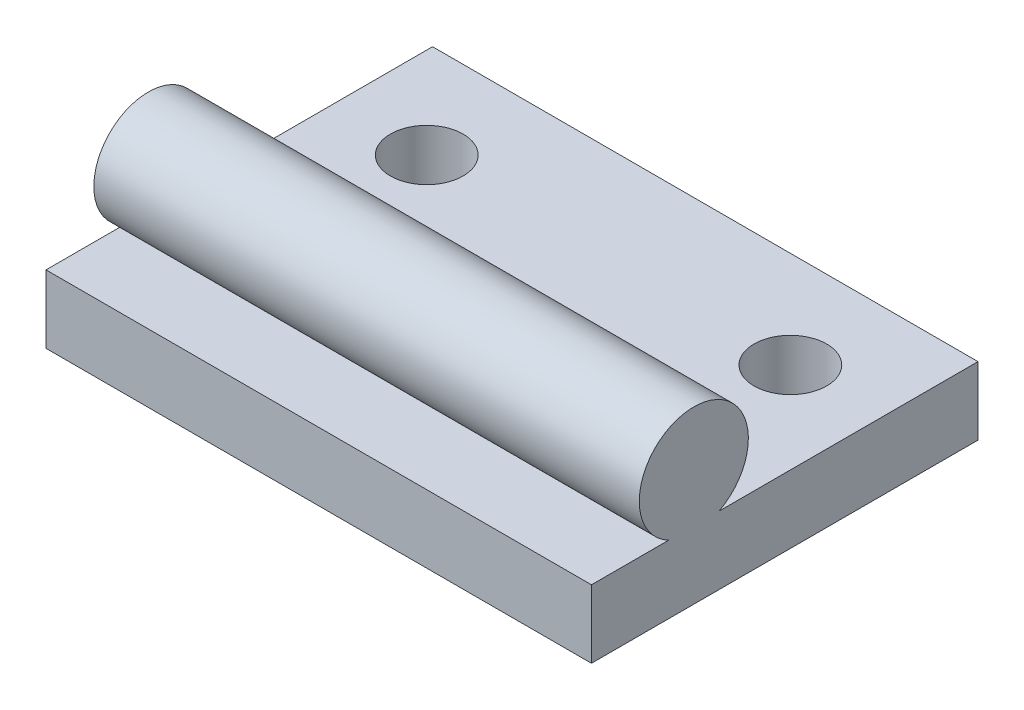
from build123d import *

# Parameters (mm, degrees)
SKETCH1_W           = 38.1
SKETCH1_H           = 12.7
BOSS_EXTRUDE1_DEPTH = 4.7498
SKETCH2_R           = 2.54
CUT_EXTRUDE1_DEPTH  = 4.7498
SKETCH4_W           = 38.1
SKETCH4_H           = 4.749919389
BOSS_EXTRUDE2_DEPTH = 14.3002
SKETCH5_R           = 3.81
BOSS_EXTRUDE3_DEPTH = 38.1


with BuildPart() as part:
    # Sketch1 → Boss-Extrude1 (new body)
    with BuildSketch(Plane(origin=(0, 0, 0), x_dir=(1, 0, 0), z_dir=(0, 1, 0))):
        with Locations((19.05, 6.35)):
            Rectangle(SKETCH1_W, SKETCH1_H)
    extrude(amount=BOSS_EXTRUDE1_DEPTH)

    # Sketch2 → Cut-Extrude1 (cut)
    with BuildSketch(Plane(origin=(0, 4.7498, 0), x_dir=(1, 0, 0), z_dir=(0, 1, 0))):
        with Locations(Location((6.35, 5.9436, 0), (0, 0, 270))):
            Circle(SKETCH2_R)
        with Locations(Location((31.75, 5.9436, 0), (0, 0, 270))):
            Circle(SKETCH2_R)
    extrude(amount=-CUT_EXTRUDE1_DEPTH, mode=Mode.SUBTRACT)

    # Sketch4 → Boss-Extrude2 (add)
    with BuildSketch(Plane.XY):
        with Locations((19.05, 2.374840306)):
            Rectangle(SKETCH4_W, SKETCH4_H)
    extrude(amount=BOSS_EXTRUDE2_DEPTH)

    # Sketch5 → Boss-Extrude3 (add)
    with BuildSketch(Plane.ZY):
        with Locations((7.1501, 8.127910458)):
            Circle(SKETCH5_R)
    extrude(amount=-BOSS_EXTRUDE3_DEPTH)


solid = part.part
